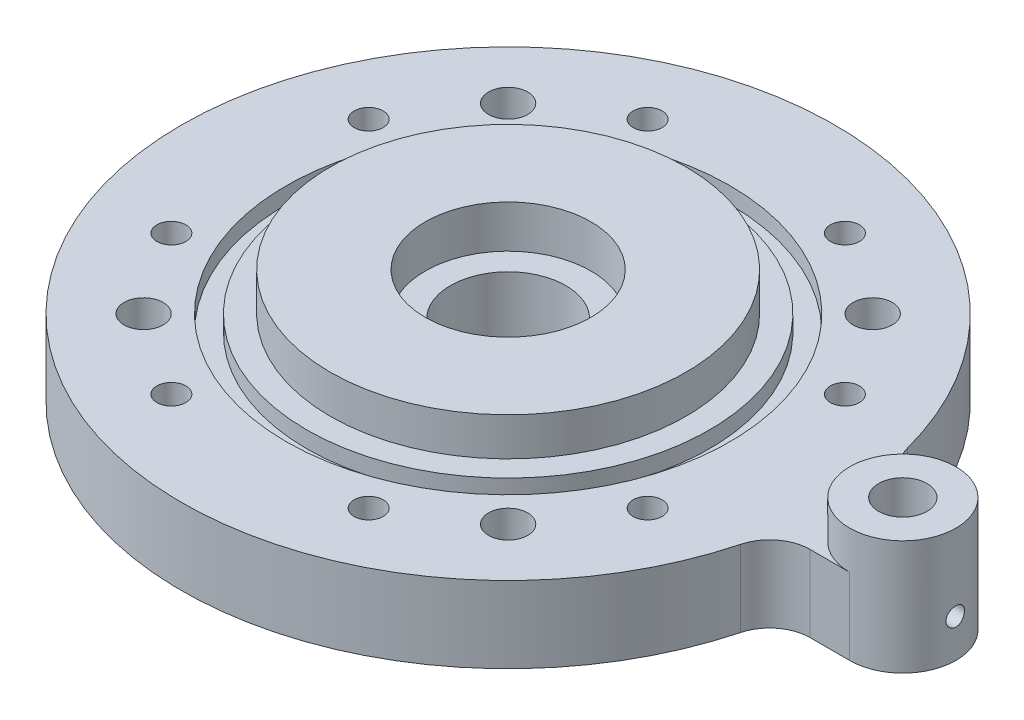
from build123d import *

# Parameters (mm, degrees)
BASE_DEPTH                       = 13.175
SKETCH3_R                        = 3.373437
SKETCH3_R_2                      = 3.373438
SQUARE_BOLT_HOLES_DEPTH          = 97.509984
SKETCH4_R                        = 2.5
HOUSING_BOLTS_DEPTH              = 44.33
CIRPATTERN1_COUNT                = 8
SKETCH2_R                        = 30.6705
SKETCH2_R_2                      = 9.167187
SKETCH2_R_3                      = 4.167187
IMPELLER_CAVITY_RISER_DEPTH      = 6.59
SKETCH5_R                        = 14.2875
SEAL_BORE_DEPTH                  = 7.35
SKETCH6_R                        = 9.9375
BORE_DEPTH                       = 39.3
PRESSURE_TAP_DEPTH               = 128.557006
PRESSURE_TAP_DEPTH_BACK          = 56.35625
SKETCH9_R                        = 1.5875
SKETCH10_R                       = 1.5875
PRESSURE_TAP_VERTICAL_HOLE_DEPTH = 8.175
SKETCH12_R                       = 38.2524
SKETCH12_R_2                     = 34.7218
O_RING_FEATURE_DEPTH             = 2.82448


with BuildPart() as part:
    # Sketch1 → base (new body)
    with BuildSketch(Plane(origin=(0, 0, 0), x_dir=(1, 0, 0), z_dir=(0, 1, 0))):
        with BuildLine():
            Line((61.258766, 9.167187), (68.063437, 9.167187))
            ThreePointArc((68.063437, 9.167187), (77.230625, 0), (68.063437, -9.167187))
            Line((68.063437, -9.167187), (61.258766, -9.167187))
            ThreePointArc((61.258766, -9.167187), (56.986985, -10.621749), (54.49051, -14.380934))
            ThreePointArc((54.49051, -14.380934), (-56.35625, 0), (54.49051, 14.380934))
            ThreePointArc((54.49051, 14.380934), (56.986985, 10.621749), (61.258766, 9.167187))
        make_face()
    extrude(amount=BASE_DEPTH)

    # Sketch3 → square bolt holes (cut, through all)
    with BuildSketch(Plane.XZ):
        with Locations(Location((-31.430896, -31.430896, 0), (0, 0, 270))):
            Circle(SKETCH3_R)
        with Locations(Location((-31.430896, 31.430896, 0), (0, 0, 270))):
            Circle(SKETCH3_R)
        with Locations(Location((31.430896, 31.430896, 0), (0, 0, 270))):
            Circle(SKETCH3_R_2)
        with Locations(Location((31.430896, -31.430896, 0), (0, 0, 270))):
            Circle(SKETCH3_R_2)
    extrude(amount=-SQUARE_BOLT_HOLES_DEPTH, mode=Mode.SUBTRACT)

    # Sketch4 → housing bolts (cut)
    with BuildSketch(Plane(origin=(0, 13.175, 0), x_dir=(1, 0, 0), z_dir=(0, 1, 0))):
        with Locations(Location((17.010279, 41.066445, 0), (0, 0, 270))):
            Circle(SKETCH4_R)
    housing_bolts = extrude(amount=-HOUSING_BOLTS_DEPTH, mode=Mode.SUBTRACT)

    # CirPattern1: housing bolts ×8 about axis
    cirpattern1_axis = Axis((0, 0, 0), (0, 1, 0))
    for i in range(1, CIRPATTERN1_COUNT):
        add(housing_bolts.rotate(cirpattern1_axis, i * 360 / CIRPATTERN1_COUNT), mode=Mode.SUBTRACT)

    # Sketch2 → impeller cavity riser (add)
    # profile 1 of 2: a face of its own
    with BuildSketch(Plane(origin=(0, 13.175, 0), x_dir=(1, 0, 0), z_dir=(0, 1, 0))):
        with Locations(Location((0, 0, 0), (0, 0, 270))):
            Circle(SKETCH2_R)
    # profile 2 of 2: a face of its own
    with BuildSketch(Plane(origin=(0, 13.175, 0), x_dir=(1, 0, 0), z_dir=(0, 1, 0))):
        with Locations(Location((68.063437, 0, 0), (0, 0, 270))):
            Circle(SKETCH2_R_2)
        with Locations(Location((68.063437, 0, 0), (0, 0, 270))):
            Circle(SKETCH2_R_3, mode=Mode.SUBTRACT)
    extrude(amount=IMPELLER_CAVITY_RISER_DEPTH)

    # Sketch5 → seal bore (cut)
    with BuildSketch(Plane(origin=(0, 19.765, 0), x_dir=(1, 0, 0), z_dir=(0, 1, 0))):
        with Locations(Location((0, 0, 0), (0, 0, 270))):
            Circle(SKETCH5_R)
    extrude(amount=-SEAL_BORE_DEPTH, mode=Mode.SUBTRACT)

    # Sketch6 → bore (cut)
    with BuildSketch(Plane(origin=(0, 12.415, 0), x_dir=(1, 0, 0), z_dir=(0, 1, 0))):
        with Locations(Location((0, 0, 0), (0, 0, 270))):
            Circle(SKETCH6_R)
    extrude(amount=-BORE_DEPTH, mode=Mode.SUBTRACT)

    # Sketch9 → pressure tap (cut, two sides: drawn at the far end of the back side and taken through both)
    with BuildSketch(Plane(origin=(56.35625, 0, 0), x_dir=(0, 0, -1), z_dir=(1, 0, 0)).offset(-PRESSURE_TAP_DEPTH_BACK)):
        with Locations(Location((0, 6.5875, 0), (0, 0, 180))):
            Circle(SKETCH9_R)
    extrude(amount=PRESSURE_TAP_DEPTH + PRESSURE_TAP_DEPTH_BACK, mode=Mode.SUBTRACT)

    # Sketch10 → pressure tap vertical hole (cut)
    with BuildSketch(Plane(origin=(0, 13.175, 0), x_dir=(1, 0, 0), z_dir=(0, 1, 0))):
        with Locations(Location((68.063437, 0, 0), (0, 0, 270))):
            Circle(SKETCH10_R)
    extrude(amount=-PRESSURE_TAP_VERTICAL_HOLE_DEPTH, mode=Mode.SUBTRACT)

    # Sketch12 → o ring feature (cut)
    with BuildSketch(Plane(origin=(0, 13.175, 0), x_dir=(1, 0, 0), z_dir=(0, 1, 0))):
        with Locations(Location((0, 0, 0), (0, 0, 270))):
            Circle(SKETCH12_R)
        with Locations(Location((0, 0, 0), (0, 0, 270))):
            Circle(SKETCH12_R_2, mode=Mode.SUBTRACT)
    extrude(amount=-O_RING_FEATURE_DEPTH, mode=Mode.SUBTRACT)


solid = part.part
